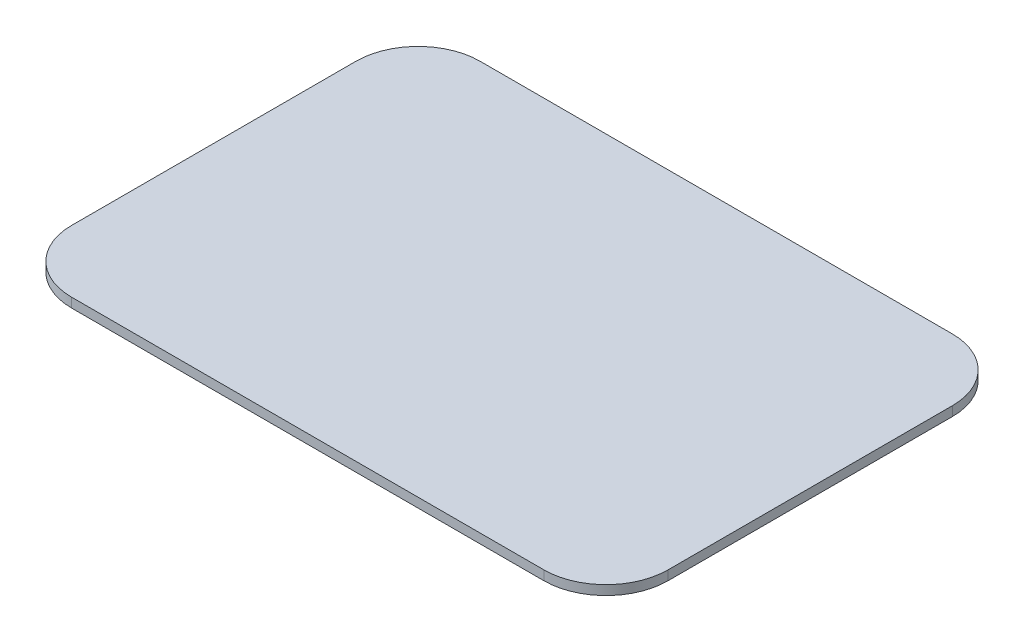
from build123d import *

# Parameters (mm, degrees)
EXTRUDE_1_DEPTH = 2


with BuildPart() as part:
    # 草图1 → 凸台-拉伸1 (new body)
    with BuildSketch(Plane(origin=(0, 0, 0), x_dir=(1, 0, 0), z_dir=(0, 1, 0))):
        with BuildLine():
            Line((-50, 43.252301346), (50, 43.252301346))
            ThreePointArc((50, 43.252301346), (59.298454173, 39.400755519), (63.15, 30.102301346))
            Line((63.15, 30.102301346), (63.15, -30.102301346))
            ThreePointArc((63.15, -30.102301346), (59.298454173, -39.400755519), (50, -43.252301346))
            Line((50, -43.252301346), (-50, -43.252301346))
            ThreePointArc((-50, -43.252301346), (-59.298454173, -39.400755519), (-63.15, -30.102301346))
            Line((-63.15, -30.102301346), (-63.15, 30.102301346))
            ThreePointArc((-63.15, 30.102301346), (-59.298454173, 39.400755519), (-50, 43.252301346))
        make_face()
    extrude(amount=EXTRUDE_1_DEPTH)


solid = part.part
